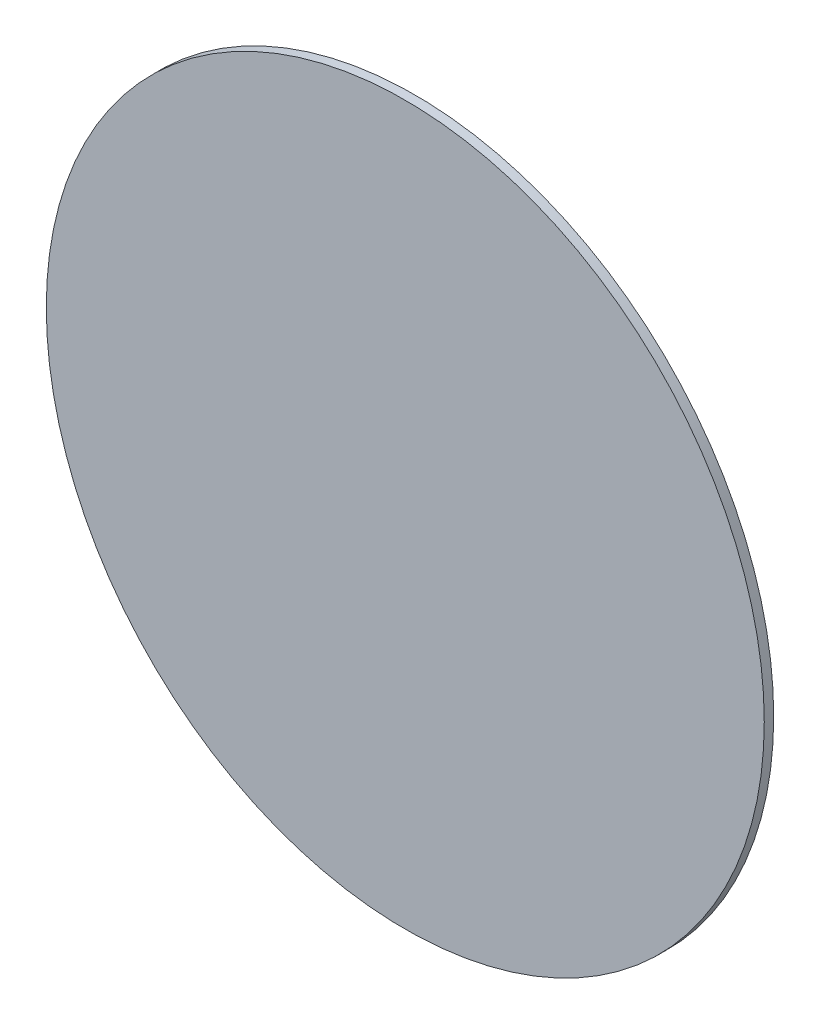
from build123d import *

# Parameters (mm, degrees)
ESQUISSE1_R        = 190
BOSS_EXTRU_1_DEPTH = 5


with BuildPart() as part:
    # Esquisse1 → Boss.-Extru.1 (new body)
    with BuildSketch(Plane.XY):
        Circle(ESQUISSE1_R)
    extrude(amount=BOSS_EXTRU_1_DEPTH)


solid = part.part
